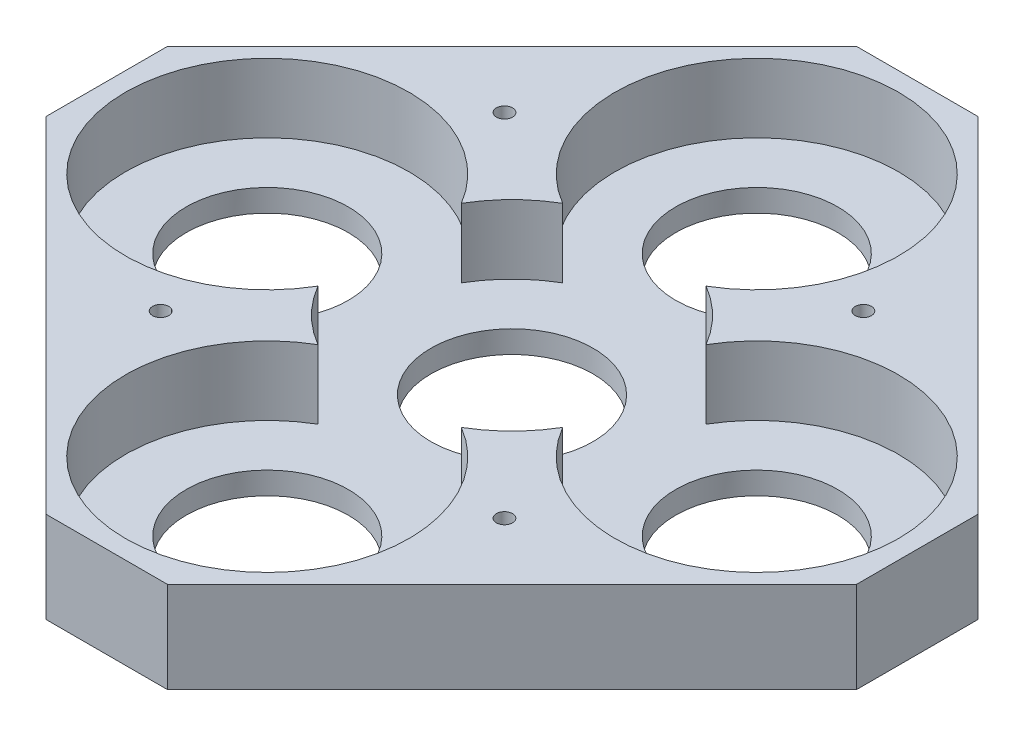
from build123d import *

# Parameters (mm, degrees)
SKETCH1_W                  = 254
SKETCH1_H                  = 254
BOSS_EXTRUDE1_DEPTH        = 28.575
CUT_EXTRUDE1_DEPTH         = 21.59
SKETCH3_R                  = 25.4
CUT_EXTRUDE2_DEPTH         = 16.51
FILLET1_SIZE               = 107.95
F_8_0_199_DIAMETER_HOLE1_D = 5.0546


with BuildPart() as part:
    # Sketch1 → Boss-Extrude1 (new body)
    with BuildSketch(Plane(origin=(0, 0, 0), x_dir=(1, 0, 0), z_dir=(0, 1, 0))):
        with Locations((127, 127)):
            Rectangle(SKETCH1_W, SKETCH1_H)
    extrude(amount=BOSS_EXTRUDE1_DEPTH)

    # Sketch2 → Cut-Extrude1 (cut)
    with BuildSketch(Plane(origin=(0, 28.575, 0), x_dir=(1, 0, 0), z_dir=(0, 1, 0))):
        with BuildLine():
            ThreePointArc((165.354, 104.532842102), (248.158, 127), (165.354, 149.467157898))
            ThreePointArc((165.354, 149.467157898), (158.430896424, 158.430896424), (149.467157898, 165.354))
            ThreePointArc((149.467157898, 165.354), (127, 248.158), (104.532842102, 165.354))
            ThreePointArc((104.532842102, 165.354), (95.569103576, 158.430896424), (88.646, 149.467157898))
            ThreePointArc((88.646, 149.467157898), (5.842, 127), (88.646, 104.532842102))
            ThreePointArc((88.646, 104.532842102), (95.569103576, 95.569103576), (104.532842102, 88.646))
            ThreePointArc((104.532842102, 88.646), (127, 5.842), (149.467157898, 88.646))
            ThreePointArc((149.467157898, 88.646), (158.430896424, 95.569103576), (165.354, 104.532842102))
        make_face()
    extrude(amount=-CUT_EXTRUDE1_DEPTH, mode=Mode.SUBTRACT)

    # Sketch3 → Cut-Extrude2 (cut)
    with BuildSketch(Plane(origin=(0, 6.985, 0), x_dir=(1, 0, 0), z_dir=(0, 1, 0))):
        with Locations(Location((127, 127, 0), (0, 0, 270))):
            Circle(SKETCH3_R)
        with Locations(Location((127, 50.292, 0), (0, 0, 270))):
            Circle(SKETCH3_R)
        with Locations(Location((50.292, 127, 0), (0, 0, 270))):
            Circle(SKETCH3_R)
        with Locations(Location((127, 203.708, 0), (0, 0, 270))):
            Circle(SKETCH3_R)
        with Locations(Location((203.708, 127, 0), (0, 0, 270))):
            Circle(SKETCH3_R)
    extrude(amount=-CUT_EXTRUDE2_DEPTH, mode=Mode.SUBTRACT)

    # Fillet1
    fillet1_edges = [part.edges().sort_by_distance(p)[0] for p in [
        (0, 14.2875, -254),
        (254, 14.2875, -254),
        (254, 14.2875, 0),
        (0, 14.2875, 0),
    ]]
    chamfer(fillet1_edges, length=FILLET1_SIZE)

    # #8 (0.199) Diameter Hole1 (through all)
    with Locations(Plane(origin=(0, 28.575, 0), x_dir=(1, 0, 0), z_dir=(0, 1, 0))):
        with Locations((70.752561211, 180.881536726), (70.752561211, 73.118463274), (180.881536726, 70.752561211), (180.881536726, 183.247438789)):
            Hole(F_8_0_199_DIAMETER_HOLE1_D / 2)


solid = part.part
